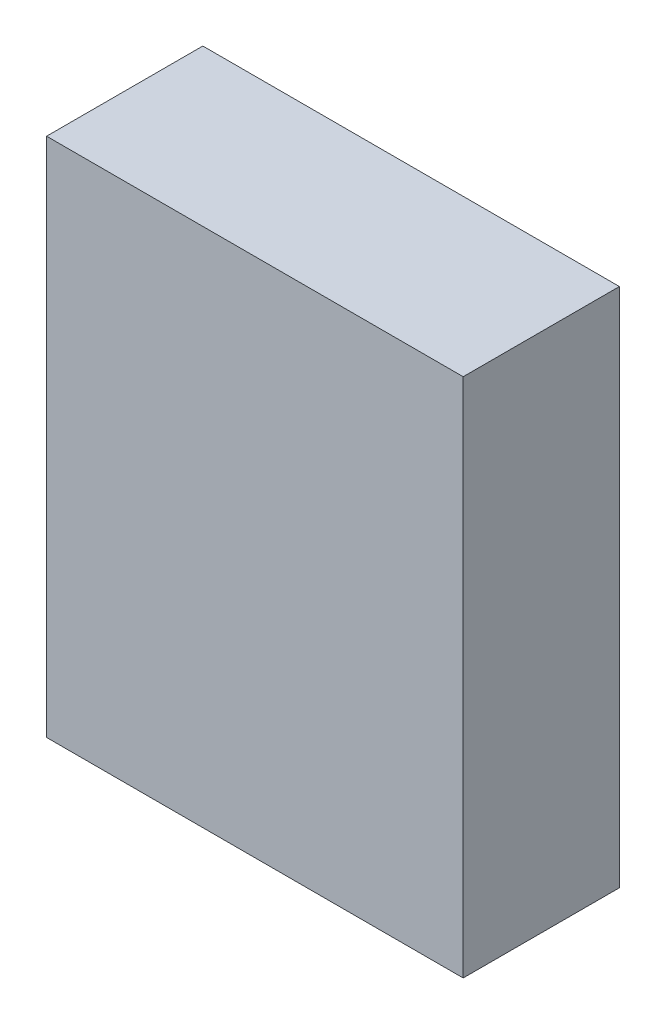
from build123d import *

# Parameters (mm, degrees)
SKETCH1_W           = 101.6
SKETCH1_H           = 127
BOSS_EXTRUDE1_DEPTH = 38.1


with BuildPart() as part:
    # Sketch1 → Boss-Extrude1 (new body)
    with BuildSketch(Plane.XY):
        Rectangle(SKETCH1_W, SKETCH1_H)
    extrude(amount=BOSS_EXTRUDE1_DEPTH)


solid = part.part
